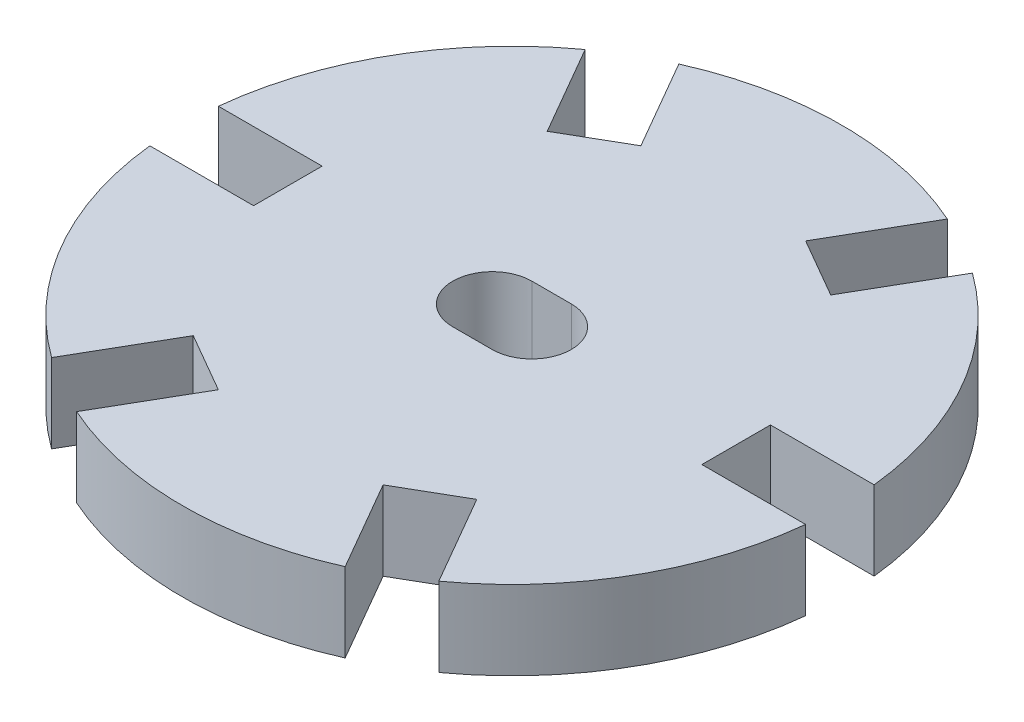
from build123d import *

# Parameters (mm, degrees)
BOSS_EXTRUDE1_DEPTH      = 1.5
BOSS_EXTRUDE1_DEPTH_BACK = 1.5
SKETCH1_R                = 12.5
SKETCH2_W                = 8
SKETCH2_H                = 2.6
CUT_EXTRUDE1_DEPTH       = 18.930421077
CUT_EXTRUDE2_DEPTH       = 18.693501632
CUT_EXTRUDE2_DEPTH_BACK  = 18.693501632


with BuildPart() as part:
    # Sketch1 → Boss-Extrude1 (new, two sides: drawn at the far end of the back side and taken through both)
    with BuildSketch(Plane(origin=(0, 0, 0), x_dir=(1, 0, 0), z_dir=(0, 1, 0)).offset(-BOSS_EXTRUDE1_DEPTH_BACK)):
        Circle(SKETCH1_R)
    extrude(amount=BOSS_EXTRUDE1_DEPTH + BOSS_EXTRUDE1_DEPTH_BACK)

    # Sketch2 → Cut-Extrude1 (cut, through all)
    with BuildSketch(Plane(origin=(0, 1.5, 0), x_dir=(1, 0, 0), z_dir=(0, 1, 0))):
        Polygon((9.375833025, 13.639419162), (5.375833025, 6.711215932), (3.124166975, 8.011215932), (7.124166975, 14.939419162), align=None)
        with Locations((12.5, 0)):
            Rectangle(SKETCH2_W, SKETCH2_H)
        Polygon((-7.124166975, 14.939419162), (-3.124166975, 8.011215932), (-5.375833025, 6.711215932), (-9.375833025, 13.639419162), align=None)
        with Locations((-12.5, 0)):
            Rectangle(SKETCH2_W, SKETCH2_H)
        Polygon((-9.375833025, -13.639419162), (-5.375833025, -6.711215932), (-3.124166975, -8.011215932), (-7.124166975, -14.939419162), align=None)
        Polygon((7.124166975, -14.939419162), (3.124166975, -8.011215932), (5.375833025, -6.711215932), (9.375833025, -13.639419162), align=None)
    extrude(amount=-CUT_EXTRUDE1_DEPTH, mode=Mode.SUBTRACT)

    # Sketch3 → Cut-Extrude2 (cut, two sides: drawn at the far end of the back side and taken through both)
    with BuildSketch(Plane(origin=(0, 0, 0), x_dir=(1, 0, 0), z_dir=(0, 1, 0)).offset(-CUT_EXTRUDE2_DEPTH_BACK)):
        with BuildLine():
            Line((-0.746821454, 1.5), (0.746821454, 1.5))
            ThreePointArc((0.746821454, 1.5), (2.246821454, 0), (0.746821454, -1.5))
            Line((0.746821454, -1.5), (-0.746821454, -1.5))
            ThreePointArc((-0.746821454, -1.5), (-2.246821454, 0), (-0.746821454, 1.5))
        make_face()
    extrude(amount=CUT_EXTRUDE2_DEPTH + CUT_EXTRUDE2_DEPTH_BACK, mode=Mode.SUBTRACT)


solid = part.part
